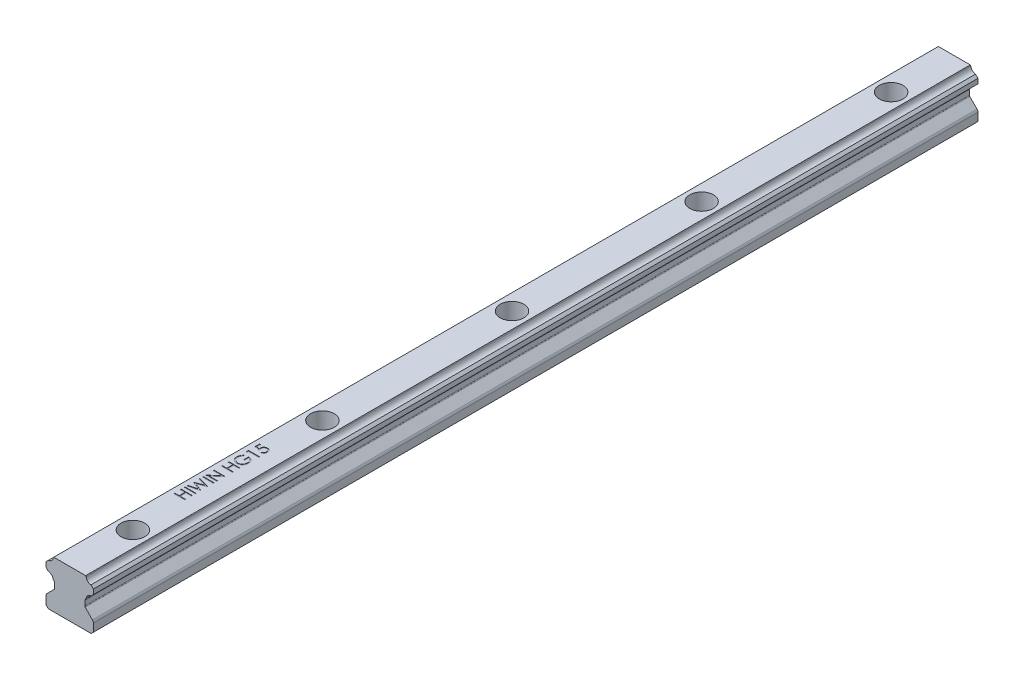
from build123d import *

# Parameters (mm, degrees)
EXTRUDE_1_DEPTH              = 280
HOLE_WIZARD_M4_1_D           = 4.5
HOLE_WIZARD_M4_1_CBORE_D     = 7.5
HOLE_WIZARD_M4_1_CBORE_DEPTH = 5.3
PATTERN_LINEAR_1_COUNT       = 5
PATTERN_LINEAR_1_PITCH       = 60
SKETCH_6_W                   = 3.5
SKETCH_6_H                   = 0.314102564
CUT_EXTRUDE_1_DEPTH          = 0.1


with BuildPart() as part:
    # 草图1 → 凸台-拉伸1 (new body)
    with BuildSketch(Plane.XY):
        with BuildLine():
            Line((7.5, 12.548994949), (6.730359225, 13.318635725))
            ThreePointArc((6.730359225, 13.318635725), (5.723905866, 13.746099326), (5.218323295, 14.715666114))
            ThreePointArc((5.218323295, 14.715666114), (5.180299299, 14.839173933), (5.104881891, 14.944113058))
            Line((5.104881891, 14.944113058), (5.04899495, 15))
            Line((5.04899495, 15), (-5.04899495, 15))
            Line((-5.04899495, 15), (-5.104881891, 14.944113058))
            ThreePointArc((-5.104881891, 14.944113058), (-5.180299299, 14.839173933), (-5.218323294, 14.715666114))
            ThreePointArc((-5.218323294, 14.715666114), (-5.723905866, 13.746099326), (-6.730359225, 13.318635725))
            Line((-6.730359225, 13.318635725), (-7.5, 12.548994949))
            Line((-7.5, 12.548994949), (-7.5, 11.011005051))
            Line((-7.5, 11.011005051), (-6.741857404, 10.252862454))
            ThreePointArc((-6.741857404, 10.252862454), (-5.724401564, 9.825237084), (-5.216972518, 8.845137289))
            ThreePointArc((-5.216972518, 8.845137289), (-5.179171399, 8.720266667), (-5.10319759, 8.614202641))
            Line((-5.10319759, 8.614202641), (-4.887157287, 8.398162338))
            ThreePointArc((-4.887157287, 8.398162338), (-4.800448187, 8.268392999), (-4.77, 8.115319626))
            Line((-4.77, 8.115319626), (-4.77, 6.553259018))
            ThreePointArc((-4.77, 6.553259018), (-4.800448187, 6.400185645), (-4.887157287, 6.270416306))
            Line((-4.887157287, 6.270416306), (-7.207106781, 3.950466812))
            ThreePointArc((-7.207106781, 3.950466812), (-7.423879533, 3.626043463), (-7.5, 3.243360031))
            Line((-7.5, 3.243360031), (-7.5, 0.7))
            Line((-7.5, 0.7), (-6.8, 0))
            Line((-6.8, 0), (6.8, 0))
            Line((6.8, 0), (7.5, 0.7))
            Line((7.5, 0.7), (7.5, 3.243360031))
            ThreePointArc((7.5, 3.243360031), (7.423879533, 3.626043463), (7.207106781, 3.950466812))
            Line((7.207106781, 3.950466812), (4.887157287, 6.270416306))
            ThreePointArc((4.887157287, 6.270416306), (4.800448187, 6.400185645), (4.77, 6.553259018))
            Line((4.77, 6.553259018), (4.77, 8.115319626))
            ThreePointArc((4.77, 8.115319626), (4.800448187, 8.268392999), (4.887157287, 8.398162338))
            Line((4.887157287, 8.398162338), (5.10319759, 8.614202641))
            ThreePointArc((5.10319759, 8.614202641), (5.179171399, 8.720266667), (5.216972518, 8.845137289))
            ThreePointArc((5.216972518, 8.845137289), (5.724401564, 9.825237084), (6.741857404, 10.252862454))
            Line((6.741857404, 10.252862454), (7.5, 11.011005051))
            Line((7.5, 11.011005051), (7.5, 12.548994949))
        make_face()
    extrude(amount=-EXTRUDE_1_DEPTH)

    # M4 六角凹头螺钉的柱形沉头孔1 (through all)
    with Locations(Plane(origin=(0.291487344, 15, -3.466272926), x_dir=(-1, 0, 0), z_dir=(0, 1, 0))):
        with Locations((0.291487344, -16.533727074)):
            hole_wizard_m4_1 = CounterBoreHole(HOLE_WIZARD_M4_1_D / 2, HOLE_WIZARD_M4_1_CBORE_D / 2, HOLE_WIZARD_M4_1_CBORE_DEPTH)

    # 阵列(线性)1: M4 六角凹头螺钉的柱形沉头孔1 ×5
    with Locations(*[(0, 0, -i * PATTERN_LINEAR_1_PITCH) for i in range(1, PATTERN_LINEAR_1_COUNT)]):
        add(hole_wizard_m4_1, mode=Mode.SUBTRACT)

    # 草图6 → 切除-拉伸1 (cut)
    with BuildSketch(Plane(origin=(0, 15, 0), x_dir=(1, 0, 0), z_dir=(0, 1, 0))):
        Polygon((-3.5, 36.403846154), (-3.5, 36.717948718), (-2.064102564, 36.717948718), (-2.064102564, 38.512820513), (-3.5, 38.512820513), (-3.5, 38.826923077), (0, 38.826923077), (0, 38.512820513), (-1.705128205, 38.512820513), (-1.705128205, 36.717948718), (0, 36.717948718), (0, 36.403846154), align=None)
        with Locations((-1.75, 39.881410256)):
            Rectangle(SKETCH_6_W, SKETCH_6_H)
        Polygon((-3.5, 40.576923077), (-3.5, 40.901542468), (-0.933193109, 41.586538462), (-3.5, 42.605268429), (-3.5, 42.650841346), (-0.950721154, 43.650641026), (-3.5, 44.339142628), (-3.5, 44.66025641), (0, 43.716546474), (0, 43.671674679), (-2.676883013, 42.618589744), (0, 41.552884615), (0, 41.508012821), align=None)
        with Locations((-1.75, 45.625)):
            Rectangle(SKETCH_6_W, SKETCH_6_H)
        Polygon((0, 46.544871795), (-3.5, 46.544871795), (-3.5, 46.610777244), (-0.745292468, 48.923076923), (-3.5, 48.923076923), (-3.5, 49.237179487), (0, 49.237179487), (0, 49.165665064), (-2.748397436, 46.858974359), (0, 46.858974359), align=None)
        Polygon((-3.5, 51.480769231), (-3.5, 51.794871795), (-2.064102564, 51.794871795), (-2.064102564, 53.58974359), (-3.5, 53.58974359), (-3.5, 53.903846154), (0, 53.903846154), (0, 53.58974359), (-1.705128205, 53.58974359), (-1.705128205, 51.794871795), (0, 51.794871795), (0, 51.480769231), align=None)
        with BuildLine():
            Line((-2.902644231, 58.076923077), (-2.647435897, 57.807692308))
            add(Edge.make_bspline(
                [(-2.647435897, 57.807692308), (-2.69328212, 57.758983227), (-2.783881335, 57.662726562), (-2.901244074, 57.50552662), (-3.002777003, 57.342170767), (-3.084772592, 57.172394867), (-3.149094254, 57.000650867), (-3.195850217, 56.829891913), (-3.225460377, 56.661223615), (-3.229016796, 56.549059313), (-3.230769231, 56.493790064)],
                knots=[0, 0, 0, 0, 1.089067066, 2.152164705, 3.18986567, 4.218445106, 5.218487318, 6.173592265, 7.100032889, 8, 8, 8, 8], degree=3))
            add(Edge.make_bspline(
                [(-3.230769231, 56.493790064), (-3.230355625, 56.459875364), (-3.229529486, 56.392133924), (-3.218985271, 56.29151198), (-3.203820407, 56.191945342), (-3.181878529, 56.093621968), (-3.15406947, 55.99635068), (-3.119284004, 55.900469793), (-3.078728771, 55.805800421), (-3.031866252, 55.713234402), (-2.980386575, 55.623493669), (-2.923337414, 55.538737672), (-2.862550889, 55.458421211), (-2.796491613, 55.384072004), (-2.725807311, 55.31519549), (-2.651770944, 55.250524789), (-2.572926872, 55.191265211), (-2.489599321, 55.138479571), (-2.403726867, 55.090811977), (-2.316037795, 55.049619777), (-2.227346143, 55.013809823), (-2.136984078, 54.986535862), (-2.045883197, 54.963434988), (-1.953566086, 54.947353752), (-1.859791669, 54.938257435), (-1.796993971, 54.936686944), (-1.765424679, 54.935897436)],
                knots=[0, 0, 0, 0, 1.028150113, 2.053633673, 3.06513288, 4.081487945, 5.106702018, 6.131327874, 7.172780699, 8.228344599, 9.276313556, 10.308389736, 11.324843658, 12.329040066, 13.321460474, 14.316307835, 15.308626991, 16.309440696, 17.305625405, 18.28535951, 19.246194545, 20.203493668, 21.145557131, 22.095268976, 23.042464743, 24, 24, 24, 24], degree=3))
            add(Edge.make_bspline(
                [(-1.765424679, 54.935897436), (-1.733154018, 54.936653631), (-1.668700816, 54.938163957), (-1.572504414, 54.947817154), (-1.477747832, 54.965772364), (-1.384282029, 54.989584114), (-1.291920993, 55.019856789), (-1.20076111, 55.057049303), (-1.110811241, 55.101355435), (-1.022964324, 55.152526704), (-0.937464192, 55.209036172), (-0.856251713, 55.271187356), (-0.780271995, 55.339084893), (-0.708415252, 55.411483836), (-0.641134974, 55.489043832), (-0.579242122, 55.572517364), (-0.521779643, 55.660735956), (-0.469378807, 55.753738745), (-0.42257144, 55.850542725), (-0.38094723, 55.949799156), (-0.346667976, 56.051827058), (-0.31872985, 56.156089724), (-0.295829559, 56.262463002), (-0.281097077, 56.371486803), (-0.270406246, 56.482359512), (-0.269624576, 56.557098144), (-0.269230769, 56.594751603)],
                knots=[0, 0, 0, 0, 0.935915162, 1.869274651, 2.799799983, 3.730201895, 4.664668062, 5.616159355, 6.583070886, 7.570012957, 8.562524459, 9.553461134, 10.53281078, 11.515274572, 12.509912756, 13.507571325, 14.526460018, 15.561318395, 16.601025881, 17.643204557, 18.680545676, 19.719612342, 20.772381578, 21.833430283, 22.908478249, 24, 24, 24, 24], degree=3))
            add(Edge.make_bspline(
                [(-0.269230769, 56.594751603), (-0.270178952, 56.640130135), (-0.272040863, 56.729238255), (-0.286546735, 56.860222075), (-0.309173205, 56.986034693), (-0.342412256, 57.106266531), (-0.384484705, 57.221353926), (-0.436513285, 57.330872414), (-0.497950569, 57.435124408), (-0.567552463, 57.533658668), (-0.645100929, 57.624132689), (-0.728035637, 57.706474768), (-0.817431068, 57.77785339), (-0.911954918, 57.840400707), (-1.012511326, 57.892097951), (-1.118540888, 57.934543829), (-1.230109213, 57.967076285), (-1.307200733, 57.980431374), (-1.346153846, 57.987179487)],
                knots=[0, 0, 0, 0, 1.130199668, 2.219330667, 3.279027493, 4.311506524, 5.322739849, 6.327972234, 7.327472899, 8.33386792, 9.329086447, 10.29244429, 11.240784345, 12.174119183, 13.111530729, 14.052100829, 15.015757696, 16, 16, 16, 16], degree=3))
            Line((-1.346153846, 57.987179487), (-1.346153846, 56.820512821))
            Line((-1.346153846, 56.820512821), (-1.705128205, 56.820512821))
            Line((-1.705128205, 56.820512821), (-1.705128205, 58.301282051))
            add(Edge.make_bspline(
                [(-1.705128205, 58.301282051), (-1.638220716, 58.299576203), (-1.507270675, 58.296237549), (-1.316300404, 58.272818634), (-1.13592871, 58.235002122), (-0.965965639, 58.18334181), (-0.806652046, 58.116466529), (-0.65782618, 58.035094001), (-0.520449499, 57.93792188), (-0.393400495, 57.828411438), (-0.280071283, 57.705511481), (-0.180465345, 57.572542861), (-0.09656273, 57.429285892), (-0.028302067, 57.275876085), (0.024971927, 57.112815651), (0.062743504, 56.939727272), (0.085373467, 56.756845671), (0.088264847, 56.631508994), (0.08974359, 56.567407853)],
                knots=[0, 0, 0, 0, 1.140356446, 2.231883559, 3.274166699, 4.278491846, 5.25512956, 6.21435461, 7.1637429, 8.11826594, 9.068280886, 10.0076534, 10.945064095, 11.891975133, 12.864533718, 13.863980011, 14.907571808, 16, 16, 16, 16], degree=3))
            add(Edge.make_bspline(
                [(0.08974359, 56.567407853), (0.089174469, 56.527897717), (0.088051978, 56.449970996), (0.080074631, 56.334880068), (0.067794054, 56.222962448), (0.049248931, 56.114234439), (0.026534277, 56.008296097), (-0.002552442, 55.905676512), (-0.036221141, 55.80598477), (-0.074516815, 55.709066784), (-0.118888472, 55.615802237), (-0.168198111, 55.52577572), (-0.222191472, 55.438489595), (-0.281802318, 55.35453843), (-0.346584778, 55.273484808), (-0.416668697, 55.195851364), (-0.491839816, 55.121203486), (-0.545218826, 55.074443023), (-0.572115385, 55.05088141)],
                knots=[0, 0, 0, 0, 1.107784379, 2.184907829, 3.233506516, 4.263428166, 5.276301166, 6.270063455, 7.25232949, 8.225834625, 9.190232166, 10.146266622, 11.1027726, 12.066435141, 13.031522626, 14.010570082, 14.99756817, 16, 16, 16, 16], degree=3))
            add(Edge.make_bspline(
                [(-0.572115385, 55.05088141), (-0.614786038, 55.016695478), (-0.699419055, 54.948891066), (-0.835018999, 54.861612909), (-0.975420859, 54.787211506), (-1.121015488, 54.726843684), (-1.271666701, 54.679705598), (-1.427181992, 54.645899345), (-1.587761622, 54.626092056), (-1.696426887, 54.623238518), (-1.751402244, 54.621794872)],
                knots=[0, 0, 0, 0, 1.023165419, 2.029347347, 3.013907458, 3.994755782, 4.975994455, 5.96558838, 6.970761222, 8, 8, 8, 8], degree=3))
            add(Edge.make_bspline(
                [(-1.751402244, 54.621794872), (-1.792568496, 54.62232711), (-1.874377804, 54.623384821), (-1.99583511, 54.636210339), (-2.115135808, 54.654611751), (-2.232182344, 54.681658827), (-2.347053012, 54.715755013), (-2.45980069, 54.758308794), (-2.570493643, 54.807852572), (-2.67836343, 54.865442289), (-2.782003044, 54.929511026), (-2.880905313, 54.999118682), (-2.973467332, 55.074802367), (-3.059903521, 55.156782462), (-3.141494975, 55.243406392), (-3.216537375, 55.336492693), (-3.286205011, 55.434631029), (-3.349159221, 55.538582169), (-3.405727075, 55.6467058), (-3.455315154, 55.758766886), (-3.496298775, 55.874724704), (-3.531072472, 55.993712261), (-3.556787635, 56.11662974), (-3.575436374, 56.242585283), (-3.588196976, 56.372235393), (-3.589223231, 56.459871423), (-3.58974359, 56.504306891)],
                knots=[0, 0, 0, 0, 1.00895651, 2.005089799, 2.991467152, 3.967318338, 4.948153826, 5.927364234, 6.919980553, 7.91976625, 8.923240147, 9.905815003, 10.88314567, 11.851989312, 12.825009789, 13.798721852, 14.781296708, 15.773896486, 16.776076962, 17.771600213, 18.775744723, 19.78957137, 20.808953803, 21.851964491, 22.910847925, 24, 24, 24, 24], degree=3))
            add(Edge.make_bspline(
                [(-3.58974359, 56.504306891), (-3.589164098, 56.540545135), (-3.588015034, 56.612401313), (-3.580050386, 56.719327046), (-3.567426505, 56.82460006), (-3.550199718, 56.92837645), (-3.526736028, 57.030302816), (-3.498657743, 57.130669522), (-3.46596592, 57.229622058), (-3.426977074, 57.326850307), (-3.382723449, 57.423008023), (-3.332910027, 57.518629864), (-3.276685022, 57.61338911), (-3.213881487, 57.707450091), (-3.145578069, 57.801405949), (-3.069821245, 57.893770591), (-2.989598489, 57.986773536), (-2.931916305, 58.04657535), (-2.902644231, 58.076923077)],
                knots=[0, 0, 0, 0, 0.985871117, 1.954866573, 2.915460327, 3.869826059, 4.81536089, 5.759505086, 6.70452669, 7.649098992, 8.607881297, 9.583363685, 10.581137262, 11.603961102, 12.659522466, 13.73993555, 14.853081303, 16, 16, 16, 16], degree=3))
        make_face()
        Polygon((-3.5, 59.449018429), (-3.5, 60.096153846), (0, 60.096153846), (0, 59.782051282), (-3.141025641, 59.782051282), (-3.141025641, 59.243589744), align=None)
        with BuildLine():
            Line((-3.5, 63.596153846), (-3.141025641, 63.596153846))
            Line((-3.141025641, 63.596153846), (-3.141025641, 62.405649038))
            Line((-3.141025641, 62.405649038), (-2.220452724, 62.217047276))
            add(Edge.make_bspline(
                [(-2.220452724, 62.217047276), (-2.230682996, 62.25410315), (-2.25050253, 62.325893046), (-2.2725083, 62.431852907), (-2.285773744, 62.53244511), (-2.287585055, 62.597720481), (-2.288461538, 62.629306891)],
                knots=[0, 0, 0, 0, 1.100273476, 2.13160584, 3.095893838, 4, 4, 4, 4], degree=3))
            add(Edge.make_bspline(
                [(-2.288461538, 62.629306891), (-2.28764354, 62.668397805), (-2.28603515, 62.745260309), (-2.269673986, 62.857544614), (-2.245976174, 62.96527195), (-2.209465207, 63.066851732), (-2.164878805, 63.163891055), (-2.108721258, 63.254723386), (-2.04315746, 63.34062356), (-1.968525078, 63.420997879), (-1.885534459, 63.493570878), (-1.795933934, 63.556634421), (-1.701678739, 63.611677196), (-1.600559725, 63.654605621), (-1.494484031, 63.689639403), (-1.382227183, 63.712740767), (-1.264785773, 63.728171477), (-1.18448027, 63.729891917), (-1.143529647, 63.730769231)],
                knots=[0, 0, 0, 0, 1.052805225, 2.070078116, 3.052532748, 4.020689046, 4.973125432, 5.925915817, 6.89216474, 7.881560752, 8.877013184, 9.857446635, 10.830895175, 11.812622661, 12.812548702, 13.836681939, 14.896847428, 16, 16, 16, 16], degree=3))
            add(Edge.make_bspline(
                [(-1.143529647, 63.730769231), (-1.115007605, 63.730103556), (-1.058348972, 63.728781204), (-0.974202158, 63.7220714), (-0.891849045, 63.709103007), (-0.811440613, 63.69190289), (-0.732901554, 63.668941583), (-0.65579213, 63.642084161), (-0.580956685, 63.608702163), (-0.508064701, 63.571694489), (-0.437950402, 63.530715464), (-0.372294905, 63.484635462), (-0.309599937, 63.436755685), (-0.251727444, 63.384438189), (-0.198452948, 63.328277796), (-0.149513072, 63.268586987), (-0.104029493, 63.205907167), (-0.063861909, 63.139251137), (-0.026898788, 63.070108867), (0.003424705, 62.997480593), (0.030535245, 62.923019908), (0.05214477, 62.845655028), (0.069077325, 62.765561217), (0.080577925, 62.682606441), (0.088954363, 62.597225771), (0.08947872, 62.539350758), (0.08974359, 62.510116186)],
                knots=[0, 0, 0, 0, 1.056393913, 2.098511576, 3.122979385, 4.141471433, 5.141222888, 6.151259816, 7.162667642, 8.172852865, 9.177685681, 10.166741883, 11.141342384, 12.097242845, 13.052202613, 14.005160326, 14.953864445, 15.917140761, 16.884916217, 17.854238259, 18.828761908, 19.81781811, 20.826036654, 21.857789401, 22.917898972, 24, 24, 24, 24], degree=3))
            add(Edge.make_bspline(
                [(0.08974359, 62.510116186), (0.089050894, 62.475242894), (0.087688097, 62.406633813), (0.073496095, 62.30610057), (0.053035464, 62.209432256), (0.022721931, 62.117043177), (-0.016971483, 62.029318648), (-0.064133263, 61.945002475), (-0.12027864, 61.865139718), (-0.184894072, 61.790276377), (-0.255892818, 61.721460371), (-0.332202561, 61.65905751), (-0.413920487, 61.604193873), (-0.500780871, 61.556670445), (-0.592629648, 61.516184815), (-0.689749822, 61.484366409), (-0.791650601, 61.45868899), (-0.861804004, 61.447825441), (-0.897435897, 61.442307692)],
                knots=[0, 0, 0, 0, 1.046872515, 2.059598001, 3.044168548, 4.012104806, 4.973680974, 5.932408326, 6.910122221, 7.900780896, 8.89867654, 9.876692837, 10.858029398, 11.85084981, 12.847361615, 13.868568023, 14.917415949, 16, 16, 16, 16], degree=3))
            Line((-0.897435897, 61.442307692), (-0.897435897, 61.756410256))
            add(Edge.make_bspline(
                [(-0.897435897, 61.756410256), (-0.86405597, 61.764133979), (-0.799897896, 61.778979402), (-0.709812799, 61.811649494), (-0.62950762, 61.851206459), (-0.558491359, 61.899340396), (-0.495464081, 61.955133792), (-0.43989307, 62.019990731), (-0.389697273, 62.092289811), (-0.347784769, 62.17267219), (-0.312479137, 62.257640252), (-0.287283878, 62.346063351), (-0.272032646, 62.436668904), (-0.270168243, 62.497671524), (-0.269230769, 62.528345353)],
                knots=[0, 0, 0, 0, 1.13623081, 2.183898708, 3.172478118, 4.09966615, 5.022692284, 5.957376522, 6.927682873, 7.937366477, 8.960015386, 9.976409503, 10.982481913, 12, 12, 12, 12], degree=3))
            add(Edge.make_bspline(
                [(-0.269230769, 62.528345353), (-0.270058415, 62.558301256), (-0.271688055, 62.617284674), (-0.284028564, 62.704132513), (-0.303533592, 62.787735767), (-0.33085902, 62.868242843), (-0.367008958, 62.945258145), (-0.411417074, 63.018672781), (-0.462975425, 63.089532607), (-0.521904738, 63.1559727), (-0.586881759, 63.216808942), (-0.656357238, 63.270565902), (-0.730474586, 63.315342595), (-0.807947606, 63.353076763), (-0.889626199, 63.381730046), (-0.975127364, 63.402171031), (-1.064662347, 63.414174089), (-1.125731657, 63.415825269), (-1.156850962, 63.416666667)],
                knots=[0, 0, 0, 0, 1.027268864, 2.022700798, 3.002744649, 3.968653148, 4.933396556, 5.915045722, 6.907600446, 7.935526002, 8.956456544, 9.95700807, 10.942805781, 11.92166854, 12.907987664, 13.905483474, 14.932689774, 16, 16, 16, 16], degree=3))
            add(Edge.make_bspline(
                [(-1.156850962, 63.416666667), (-1.184930032, 63.416028195), (-1.239659043, 63.414783746), (-1.320009695, 63.404010642), (-1.396158478, 63.386014341), (-1.468436727, 63.360391264), (-1.536613353, 63.328412845), (-1.600538112, 63.288262971), (-1.660812066, 63.241651258), (-1.715884112, 63.187233139), (-1.766793088, 63.12803749), (-1.810034281, 63.062543866), (-1.846807397, 62.992500701), (-1.876936465, 62.917778197), (-1.900936575, 62.838284311), (-1.917523378, 62.753976228), (-1.92744867, 62.664834733), (-1.928795087, 62.603859089), (-1.929487179, 62.572516026)],
                knots=[0, 0, 0, 0, 1.045723156, 2.038222538, 3.013889863, 3.95567481, 4.890389958, 5.81331128, 6.76251276, 7.723027653, 8.692928204, 9.666105983, 10.639751036, 11.635719707, 12.66315958, 13.728667616, 14.832476222, 16, 16, 16, 16], degree=3))
            add(Edge.make_bspline(
                [(-1.929487179, 62.572516026), (-1.928906588, 62.545387097), (-1.927707815, 62.489372742), (-1.918881318, 62.403449915), (-1.904642024, 62.313158192), (-1.885055776, 62.218843696), (-1.859424699, 62.120223188), (-1.828710199, 62.017504787), (-1.7919882, 61.910472521), (-1.764255986, 61.838354796), (-1.75, 61.801282051)],
                knots=[0, 0, 0, 0, 0.817624296, 1.688186739, 2.600797293, 3.572016777, 4.590301741, 5.671205678, 6.80286297, 8, 8, 8, 8], degree=3))
            Line((-1.75, 61.801282051), (-3.5, 62.16025641))
            Line((-3.5, 62.16025641), (-3.5, 63.596153846))
        make_face()
    extrude(amount=-CUT_EXTRUDE_1_DEPTH, mode=Mode.SUBTRACT)


solid = part.part
